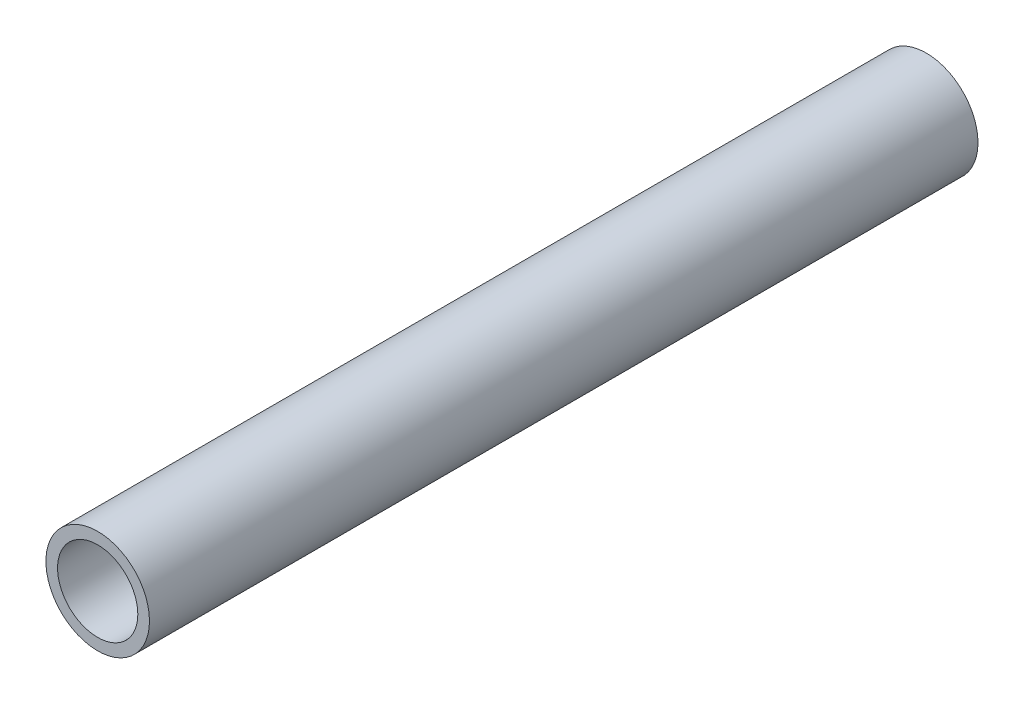
from build123d import *

# Parameters (mm, degrees)
SKETCH_1_R      = 1
SKETCH_1_R_2    = 0.775
EXTRUDE_1_DEPTH = 16


with BuildPart() as part:
    # Эскиз1 → Бобышка-Вытянуть1 (new body)
    with BuildSketch(Plane.XY):
        Circle(SKETCH_1_R)
        Circle(SKETCH_1_R_2, mode=Mode.SUBTRACT)
    extrude(amount=EXTRUDE_1_DEPTH)


solid = part.part
